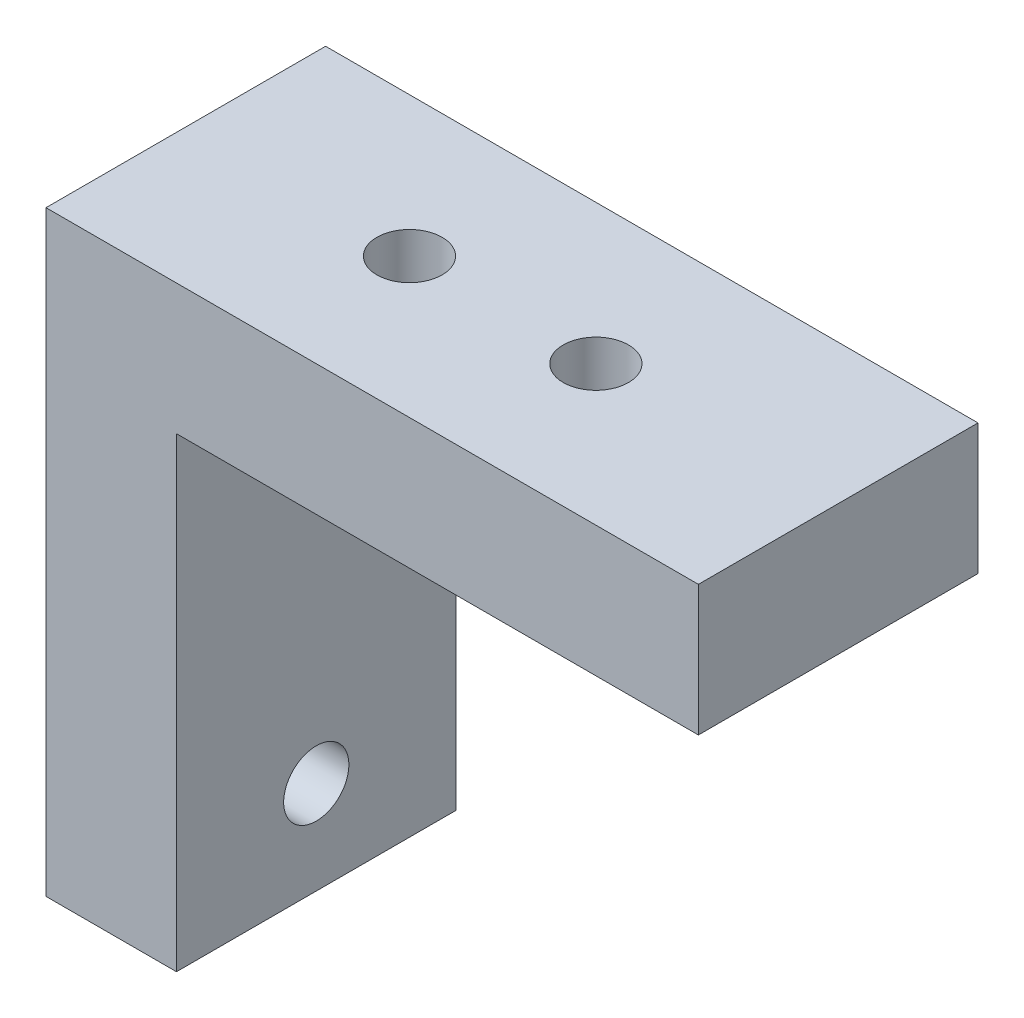
from build123d import *

# Parameters (mm, degrees)
SKETCH2_W           = 15
SKETCH2_H           = 25
BOSS_EXTRUDE1_DEPTH = 7
SKETCH3_R           = 1.75
CUT_EXTRUDE1_DEPTH  = 21.070120648
SKETCH4_W           = 35
SKETCH4_H           = 15
BOSS_EXTRUDE2_DEPTH = 7
SKETCH5_R           = 1.75
CUT_EXTRUDE2_DEPTH  = 49.540409928


with BuildPart() as part:
    # Sketch2 → Boss-Extrude1 (new body)
    with BuildSketch(Plane(origin=(0, 0, 0), x_dir=(0, 0, -1), z_dir=(1, 0, 0))):
        with Locations((2.852361856, -3.204723711)):
            Rectangle(SKETCH2_W, SKETCH2_H)
    extrude(amount=BOSS_EXTRUDE1_DEPTH)

    # Sketch3 → Cut-Extrude1 (cut, through all)
    with BuildSketch(Plane(origin=(7, 0, 0), x_dir=(0, 0, -1), z_dir=(1, 0, 0))):
        with Locations((2.852361856, -10.704723711)):
            Circle(SKETCH3_R)
        with Locations((2.852361856, 4.295276289)):
            Circle(SKETCH3_R)
    extrude(amount=-CUT_EXTRUDE1_DEPTH, mode=Mode.SUBTRACT)

    # Sketch4 → Boss-Extrude2 (add)
    with BuildSketch(Plane(origin=(0, 9.295276289, 0), x_dir=(1, 0, 0), z_dir=(0, 1, 0))):
        with Locations((17.5, 2.852361856)):
            Rectangle(SKETCH4_W, SKETCH4_H)
    extrude(amount=BOSS_EXTRUDE2_DEPTH)

    # Sketch5 → Cut-Extrude2 (cut, through all)
    with BuildSketch(Plane(origin=(0, 16.295276289, 0), x_dir=(1, 0, 0), z_dir=(0, 1, 0))):
        with Locations(Location((12, 2.852361856, 0), (0, 0, 270))):
            Circle(SKETCH5_R)
        with Locations(Location((22, 2.852361856, 0), (0, 0, 270))):
            Circle(SKETCH5_R)
    extrude(amount=-CUT_EXTRUDE2_DEPTH, mode=Mode.SUBTRACT)


solid = part.part
